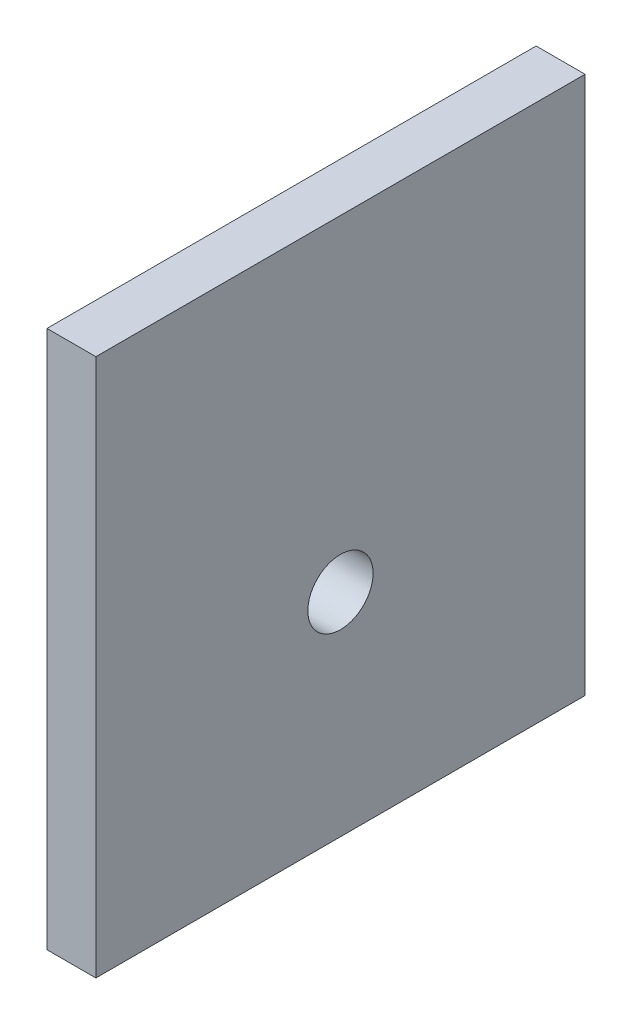
from build123d import *

# Parameters (mm, degrees)
SKETCH_1_W          = 30
SKETCH_1_H          = 40
EXTRUDE_1_DEPTH     = 3
SKETCH_2_R          = 2
CUT_EXTRUDE_1_DEPTH = 26.179356624
SKETCH_3_W          = 30
SKETCH_3_H          = 7
CUT_EXTRUDE_2_DEPTH = 26.179356624


with BuildPart() as part:
    # 草图1 → 凸台-拉伸1 (new body)
    with BuildSketch(Plane(origin=(0, 0, 0), x_dir=(0, 0, -1), z_dir=(1, 0, 0))):
        Rectangle(SKETCH_1_W, SKETCH_1_H)
    extrude(amount=EXTRUDE_1_DEPTH)

    # 草图2 → 切除-拉伸1 (cut, through all)
    with BuildSketch(Plane(origin=(3, 0, 0), x_dir=(0, 0, -1), z_dir=(1, 0, 0))):
        Circle(SKETCH_2_R)
    extrude(amount=-CUT_EXTRUDE_1_DEPTH, mode=Mode.SUBTRACT)

    # 草图3 → 切除-拉伸2 (cut, through all)
    with BuildSketch(Plane.ZY):
        with Locations((0, -16.5)):
            Rectangle(SKETCH_3_W, SKETCH_3_H)
    extrude(amount=-CUT_EXTRUDE_2_DEPTH, mode=Mode.SUBTRACT)


solid = part.part
